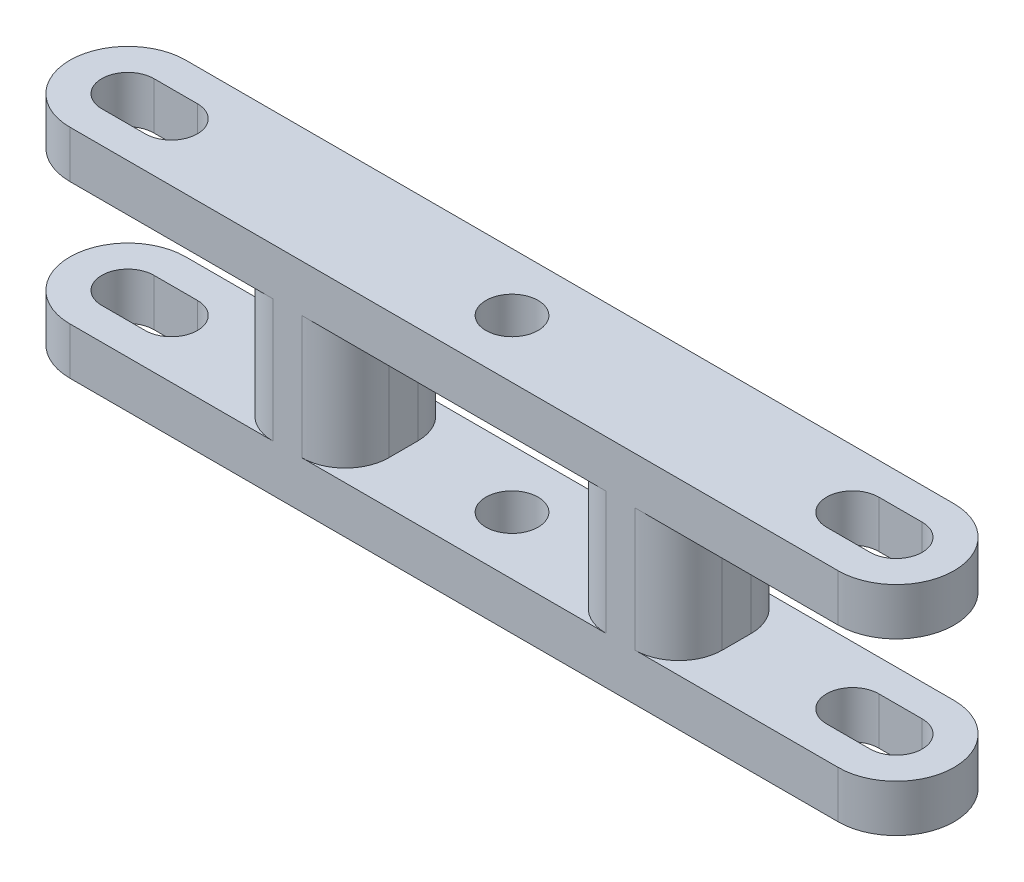
from build123d import *

# Parameters (mm, degrees)
SKETCH1_R           = 2.286
BOSS_EXTRUDE1_DEPTH = 9.525
SKETCH3_W           = 19.05
SKETCH3_H           = 10.795
CUT_EXTRUDE1_DEPTH  = 42.162500531
FILLET1_R           = 3.81


with BuildPart() as part:
    # Sketch1 → Boss-Extrude1 (new, symmetric)
    with BuildSketch(Plane(origin=(0, 0, 0), x_dir=(1, 0, 0), z_dir=(0, 1, 0))):
        with BuildLine():
            Line((33.655, -5.08), (-33.655, -5.08))
            ThreePointArc((-33.655, -5.08), (-38.735, 0), (-33.655, 5.08))
            Line((-33.655, 5.08), (33.655, 5.08))
            ThreePointArc((33.655, 5.08), (38.735, 0), (33.655, -5.08))
        make_face()
        with Locations(Location((0, 0, 0), (0, 0, 90))):
            Circle(SKETCH1_R, mode=Mode.SUBTRACT)
        with BuildLine():
            Line((33.655, -2.286), (29.845, -2.286))
            ThreePointArc((29.845, -2.286), (27.559, 0), (29.845, 2.286))
            Line((29.845, 2.286), (33.655, 2.286))
            ThreePointArc((33.655, 2.286), (35.941, 0), (33.655, -2.286))
        make_face(mode=Mode.SUBTRACT)
        with BuildLine():
            Line((-33.655, 2.286), (-29.845, 2.286))
            ThreePointArc((-29.845, 2.286), (-27.559, 0), (-29.845, -2.286))
            Line((-29.845, -2.286), (-33.655, -2.286))
            ThreePointArc((-33.655, -2.286), (-35.941, 0), (-33.655, 2.286))
        make_face(mode=Mode.SUBTRACT)
    extrude(amount=BOSS_EXTRUDE1_DEPTH, both=True)

    # Sketch3 → Cut-Extrude1 (cut, through all)
    with BuildSketch(Plane.XY.offset(5.08)):
        with Locations((-29.21, 0)):
            Rectangle(SKETCH3_W, SKETCH3_H)
        Rectangle(SKETCH3_W, SKETCH3_H)
        with Locations((29.21, 0)):
            Rectangle(SKETCH3_W, SKETCH3_H)
    extrude(amount=-CUT_EXTRUDE1_DEPTH, mode=Mode.SUBTRACT)

    # Fillet1
    fillet1_edges = [part.edges().sort_by_distance(p)[0] for p in [
        (19.685, 0, -5.08),
        (19.685, 0, 5.08),
        (-19.685, 0, 5.08),
        (-19.685, 0, -5.08),
        (-9.525, 0, -5.08),
        (9.525, 0, -5.08),
        (-9.525, 0, 5.08),
        (9.525, 0, 5.08),
    ]]
    fillet(fillet1_edges, radius=FILLET1_R)


solid = part.part
